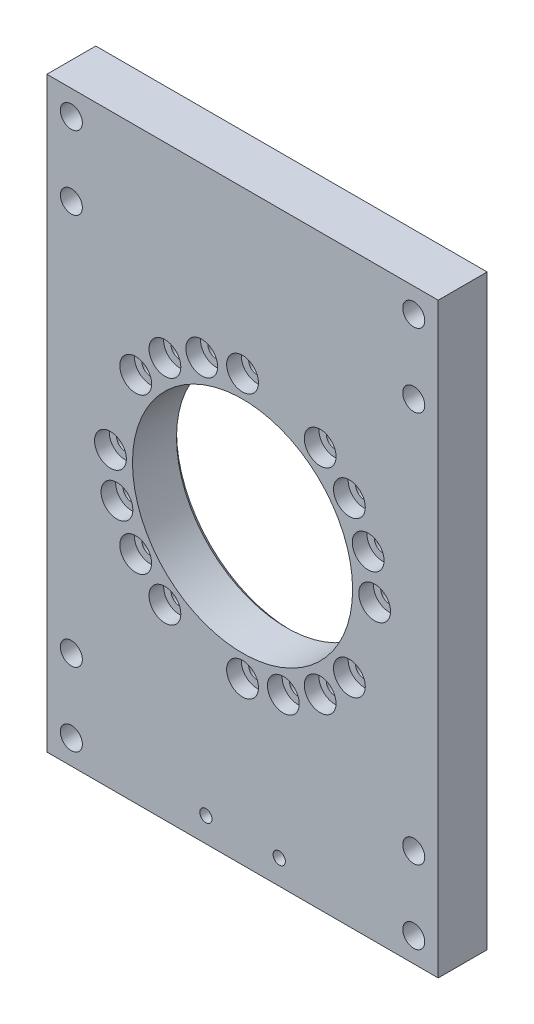
from build123d import *

# Parameters (mm, degrees)
SKETCH1_W                                           = 80
SKETCH1_H                                           = 120
SKETCH1_R                                           = 22.5
BOSS_EXTRUDE1_DEPTH                                 = 10
CBORE_FOR_M3_HEX_SOCKET_HEAD_CAP_SCREW1_D           = 3.5
CBORE_FOR_M3_HEX_SOCKET_HEAD_CAP_SCREW1_CBORE_D     = 6.5
CBORE_FOR_M3_HEX_SOCKET_HEAD_CAP_SCREW1_CBORE_DEPTH = 3
CHAMFER1_SIZE                                       = 1
F_4_5_4_5_DIAMETER_HOLE1_D                          = 4.5
M3_TAPPED_HOLE1_D                                   = 2.5


with BuildPart() as part:
    # Sketch1 → Boss-Extrude1 (new body)
    with BuildSketch(Plane.XY):
        Rectangle(SKETCH1_W, SKETCH1_H)
        Circle(SKETCH1_R, mode=Mode.SUBTRACT)
    extrude(amount=BOSS_EXTRUDE1_DEPTH)

    # CBORE for M3 Hex Socket Head Cap Screw1 (through all)
    with Locations(Plane.XY.offset(10)):
        with Locations((-27, 0), (-25.67852594, -8.343458848), (-21.843458848, -15.870201812), (-15.870201812, -21.843458848), (27, 0), (25.67852594, 8.343458848), (21.843458848, 15.870201812), (15.870201812, 21.843458848), (0, 27), (-8.343458848, 25.67852594), (-15.870201812, 21.843458848), (-21.843458848, 15.870201812), (0, -27), (8.343458848, -25.67852594), (15.870201812, -21.843458848), (21.843458848, -15.870201812)):
            CounterBoreHole(CBORE_FOR_M3_HEX_SOCKET_HEAD_CAP_SCREW1_D / 2, CBORE_FOR_M3_HEX_SOCKET_HEAD_CAP_SCREW1_CBORE_D / 2, CBORE_FOR_M3_HEX_SOCKET_HEAD_CAP_SCREW1_CBORE_DEPTH)

    # Chamfer1
    chamfer1_edges = [part.edges().sort_by_distance(p)[0] for p in [
        (-22.5, 0, 0),
    ]]
    chamfer(chamfer1_edges, length=CHAMFER1_SIZE)

    # Ø4.5 (4.5) Diameter Hole1 (through all)
    with Locations(Plane.XY.offset(10)):
        with Locations((-35, 55), (35, 55), (35, -55), (-35, -55), (-35, -40), (-35, 40), (35, 40), (35, -40)):
            Hole(F_4_5_4_5_DIAMETER_HOLE1_D / 2)

    # M3 Tapped Hole1 (through all)
    with Locations(Plane(origin=(0, 0, 0), x_dir=(-1, 0, 0), z_dir=(0, 0, -1))):
        with Locations((-7.5, -55), (7.5, -55)):
            Hole(M3_TAPPED_HOLE1_D / 2)


solid = part.part
